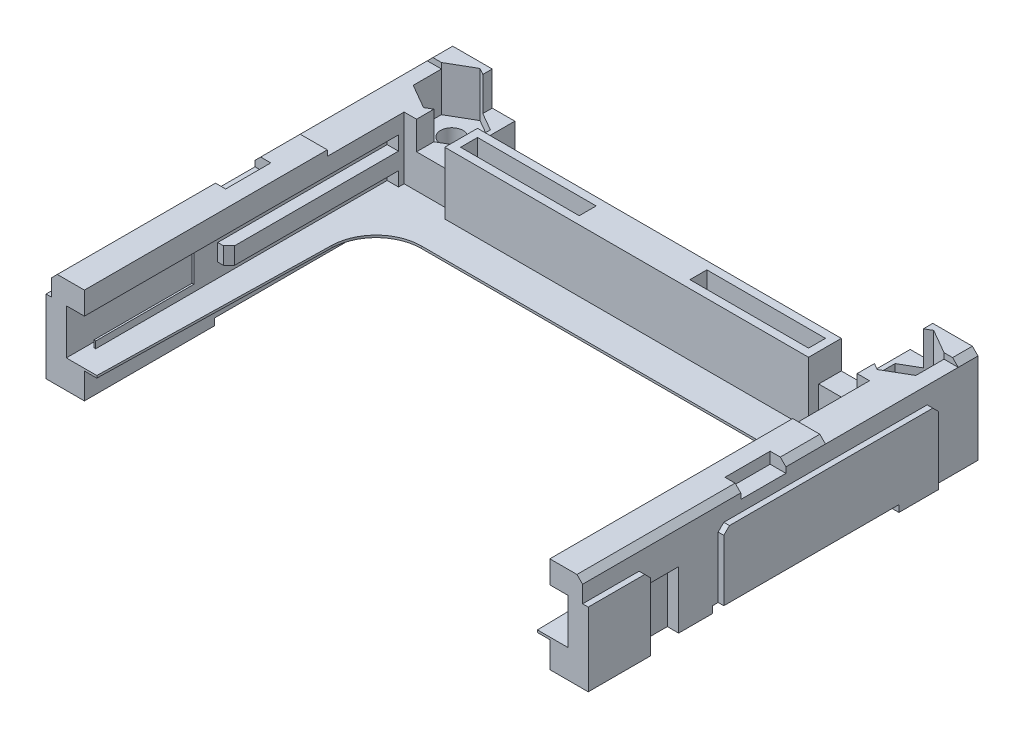
from build123d import *

# Parameters (mm, degrees)
EXTRUIR1_DEPTH         = 9.9
CROQUIS2_R             = 1
CORTAR_EXTRUIR1_DEPTH  = 15.9
CORTAR_EXTRUIR2_DEPTH  = 4
CROQUIS4_W             = 35
CROQUIS4_H             = 2.727458855
CORTAR_EXTRUIR3_DEPTH  = 24
CROQUIS5_W             = 35
CROQUIS5_H             = 3.2
CORTAR_EXTRUIR4_DEPTH  = 8.5
CROQUIS6_W             = 39
CROQUIS6_H             = 14.452712812
CORTAR_EXTRUIR5_DEPTH  = 3
EXTRUIR2_DEPTH         = 0.2
CROQUIS8_W             = 49.57319474
CROQUIS8_H             = 11.75
CORTAR_EXTRUIR6_DEPTH  = 0.5
CROQUIS9_W             = 2.460261438
CROQUIS9_H             = 4
CORTAR_EXTRUIR7_DEPTH  = 1
CHAFL_N1_SIZE          = 0.5
CHAFL_N2_SIZE          = 0.5
EXTRUIR3_START         = -5.5
CROQUIS10_W            = 32.2
CROQUIS10_H            = 2.9
EXTRUIR3_DEPTH         = 5.5
CROQUIS11_W            = 10.5
CROQUIS11_H            = 1.5
CORTAR_EXTRUIR8_DEPTH  = 2.5
CROQUIS12_W            = 16
CROQUIS12_H            = 2
CORTAR_EXTRUIR9_DEPTH  = 57.5
CROQUIS13_W            = 35
CROQUIS13_H            = 3.2
CORTAR_EXTRUIR10_DEPTH = 0.7
CROQUIS15_W            = 5.5
CROQUIS15_H            = 7.9
EXTRUIR4_DEPTH         = 0.5
CHAFL_N3_SIZE          = 0.5
CROQUIS16_W            = 3
CROQUIS16_H            = 6.5
CORTAR_EXTRUIR11_DEPTH = 1
CHAFL_N4_SIZE          = 0.5
CORTAR_EXTRUIR12_DEPTH = 1
CHAFL_N5_SIZE          = 0.5
CHAFL_N6_SIZE          = 0.5
CROQUIS18_W            = 0.4398817
CROQUIS18_H            = 4
CORTAR_EXTRUIR13_DEPTH = 22
CROQUIS19_W            = 10.696044144
CROQUIS19_H            = 2.8
CORTAR_EXTRUIR14_DEPTH = 0.2
CROQUIS20_W            = 2
CROQUIS20_H            = 4
CORTAR_EXTRUIR15_DEPTH = 0.2
CROQUIS21_W            = 42.865199157
CROQUIS21_H            = 3.067417921
CORTAR_EXTRUIR16_DEPTH = 58


with BuildPart() as part:
    # Croquis1 → Extruir1 (new body)
    with BuildSketch(Plane(origin=(0, 0, 0), x_dir=(1, 0, 0), z_dir=(0, 1, 0))):
        Polygon((23.5, 0), (-23.5, 0), (-23.5, -35), (-20.6, -35), (-20.6, -6.7), (20.6, -6.7), (20.6, -35), (23.5, -35), align=None)
    extrude(amount=EXTRUIR1_DEPTH)

    # Croquis2 → Cortar-Extruir1 (cut)
    with BuildSketch(Plane(origin=(0, 9.9, 0), x_dir=(-1, 0, 0), z_dir=(0, 1, 0))):
        with Locations(Location((-20.08, 3, 0), (0, 0, 90))):
            Circle(CROQUIS2_R)
        with Locations(Location((20.08, 3, 0), (0, 0, 90))):
            Circle(CROQUIS2_R)
    extrude(amount=-CORTAR_EXTRUIR1_DEPTH, mode=Mode.SUBTRACT)

    # Croquis3 → Cortar-Extruir2 (cut)
    with BuildSketch(Plane(origin=(0, 9.9, 0), x_dir=(-1, 0, 0), z_dir=(0, 1, 0))):
        Polygon((-20.08, 5.5), (-22.245063509, 4.25), (-22.245063509, 1.75), (-20.08, 0.5), (-17.914936491, 1.75), (-17.914936491, 4.25), align=None)
        Polygon((20.08, 5.5), (17.914936491, 4.25), (17.914936491, 1.75), (20.08, 0.5), (22.245063509, 1.75), (22.245063509, 4.25), align=None)
    extrude(amount=-CORTAR_EXTRUIR2_DEPTH, mode=Mode.SUBTRACT)

    # Croquis4 → Cortar-Extruir3 (cut)
    with BuildSketch(Plane(origin=(0, 9.9, 0), x_dir=(-1, 0, 0), z_dir=(0, 1, 0))):
        with Locations((0, 0.136270572)):
            Rectangle(CROQUIS4_W, CROQUIS4_H)
    extrude(amount=-CORTAR_EXTRUIR3_DEPTH, mode=Mode.SUBTRACT)

    # Croquis5 → Cortar-Extruir4 (cut)
    with BuildSketch(Plane(origin=(0, 9.9, 0), x_dir=(-1, 0, 0), z_dir=(0, 1, 0))):
        with Locations((0, 3.1)):
            Rectangle(CROQUIS5_W, CROQUIS5_H)
    extrude(amount=-CORTAR_EXTRUIR4_DEPTH, mode=Mode.SUBTRACT)

    # Croquis6 → Cortar-Extruir5 (cut)
    with BuildSketch(Plane(origin=(0, 9.9, 0), x_dir=(-1, 0, 0), z_dir=(0, 1, 0))):
        with Locations((0, 5.388219545)):
            Rectangle(CROQUIS6_W, CROQUIS6_H)
    extrude(amount=-CORTAR_EXTRUIR5_DEPTH, mode=Mode.SUBTRACT)

    # Croquis7 → Extruir2 (add)
    with BuildSketch(Plane(origin=(0, 3.9, 0), x_dir=(-1, 0, 0), z_dir=(0, 1, 0))):
        with BuildLine():
            Line((-20.6, 35), (-19.5, 35))
            Line((-19.5, 35), (-19.080611376, 14.617712891))
            ThreePointArc((-19.080611376, 14.617712891), (-17.880640918, 11.842628092), (-15.081457862, 10.7))
            Line((-15.081457862, 10.7), (15.081457862, 10.7))
            ThreePointArc((15.081457862, 10.7), (17.880640918, 11.842628092), (19.080611376, 14.617712891))
            Line((19.080611376, 14.617712891), (19.5, 35))
            Line((19.5, 35), (20.6, 35))
            Line((20.6, 35), (20.6, 6.7))
            Line((20.6, 6.7), (-20.6, 6.7))
            Line((-20.6, 6.7), (-20.6, 35))
        make_face()
    extrude(amount=-EXTRUIR2_DEPTH)

    # Croquis8 → Cortar-Extruir6 (cut)
    with BuildSketch(Plane(origin=(0, 9.9, 0), x_dir=(-1, 0, 0), z_dir=(0, 1, 0))):
        with Locations((0.155531932, 7.625)):
            Rectangle(CROQUIS8_W, CROQUIS8_H)
    extrude(amount=-CORTAR_EXTRUIR6_DEPTH, mode=Mode.SUBTRACT)

    # Croquis9 → Cortar-Extruir7 (cut)
    with BuildSketch(Plane(origin=(0, 9.9, 0), x_dir=(-1, 0, 0), z_dir=(0, 1, 0))):
        with Locations((23.330130719, 19)):
            Rectangle(CROQUIS9_W, CROQUIS9_H)
        with Locations((-23.330130719, 19)):
            Rectangle(CROQUIS9_W, CROQUIS9_H)
    extrude(amount=-CORTAR_EXTRUIR7_DEPTH, mode=Mode.SUBTRACT)

    # Chaflán1
    chafl_n1_edges = [part.edges().sort_by_distance(p)[0] for p in [
        (23.5, 9.9, 15.25),
        (23.5, 9.9, 28),
        (-23.5, 9.9, 28),
        (-23.5, 9.9, 15.25),
    ]]
    chamfer(chafl_n1_edges, length=CHAFL_N1_SIZE)

    # Chaflán2
    chafl_n2_edges = [part.edges().sort_by_distance(p)[0] for p in [
        (23.5, 9.9, 0.875),
        (-23.5, 9.9, 0.875),
    ]]
    chamfer(chafl_n2_edges, length=CHAFL_N2_SIZE)

    # Croquis10 → Extruir3 (add)
    with BuildSketch(Plane(origin=(0, 9.4, 0), x_dir=(-1, 0, 0), z_dir=(0, 1, 0)).offset(EXTRUIR3_START)):
        with Locations((0, 6.15)):
            Rectangle(CROQUIS10_W, CROQUIS10_H)
    extrude(amount=EXTRUIR3_DEPTH)

    # Croquis11 → Cortar-Extruir8 (cut)
    with BuildSketch(Plane(origin=(0, 9.4, 0), x_dir=(-1, 0, 0), z_dir=(0, 1, 0))):
        with Locations((-10.15, 6.15)):
            Rectangle(CROQUIS11_W, CROQUIS11_H)
        with Locations((10.15, 6.15)):
            Rectangle(CROQUIS11_W, CROQUIS11_H)
    extrude(amount=-CORTAR_EXTRUIR8_DEPTH, mode=Mode.SUBTRACT)

    # Croquis12 → Cortar-Extruir9 (cut)
    with BuildSketch(Plane.ZY.offset(23.5)):
        with Locations((15.5, 1)):
            Rectangle(CROQUIS12_W, CROQUIS12_H)
    extrude(amount=-CORTAR_EXTRUIR9_DEPTH, mode=Mode.SUBTRACT)

    # Croquis13 → Cortar-Extruir10 (cut)
    with BuildSketch(Plane.XZ):
        with Locations((0, 3.1)):
            Rectangle(CROQUIS13_W, CROQUIS13_H)
    extrude(amount=-CORTAR_EXTRUIR10_DEPTH, mode=Mode.SUBTRACT)

    # Croquis15 → Extruir4 (add)
    with BuildSketch(Plane.ZY.offset(23.5)):
        Polygon((4, 0), (4, 7.9), (23, 7.9), (23, 2), (7.5, 2), (7.5, 0), align=None)
        with Locations((32.25, 3.95)):
            Rectangle(CROQUIS15_W, CROQUIS15_H)
    extruir4 = extrude(amount=EXTRUIR4_DEPTH)

    # Chaflán3
    chafl_n3_edges = [part.edges().sort_by_distance(p)[0] for p in [
        (-23.75, 7.9, 29.5),
        (-23.75, 7.9, 23),
        (-23.75, 7.9, 4),
    ]]
    chamfer(chafl_n3_edges, length=CHAFL_N3_SIZE)

    # Croquis16 → Cortar-Extruir11 (cut)
    with BuildSketch(Plane.ZY.offset(23.5)):
        with Locations((28, 3.25)):
            Rectangle(CROQUIS16_W, CROQUIS16_H)
    cortar_extruir11 = extrude(amount=-CORTAR_EXTRUIR11_DEPTH, mode=Mode.SUBTRACT)

    # Simetría1: Extruir4, Cortar-Extruir11 across plane
    add(extruir4.mirror(Plane(origin=(0, 0, 0), x_dir=(0, 0, 1), z_dir=(1, 0, 0))))
    add(cortar_extruir11.mirror(Plane(origin=(0, 0, 0), x_dir=(0, 0, 1), z_dir=(1, 0, 0))), mode=Mode.SUBTRACT)

    # Chaflán4
    chafl_n4_edges = [part.edges().sort_by_distance(p)[0] for p in [
        (23.75, 7.9, 4),
        (23.75, 7.9, 23),
        (23.75, 7.9, 29.5),
    ]]
    chamfer(chafl_n4_edges, length=CHAFL_N4_SIZE)

    # Croquis17 → Cortar-Extruir12 (cut)
    with BuildSketch(Plane(origin=(-20.6, 0, 0), x_dir=(0, 0, -1), z_dir=(1, 0, 0))):
        Polygon((-35, 7.9), (-7.2, 7.9), (-7.2, 6.65), (-22.2, 6.65), (-22.2, 5.15), (-7.2, 5.15), (-7.2, 3.9), (-35, 3.9), align=None)
    cortar_extruir12 = extrude(amount=-CORTAR_EXTRUIR12_DEPTH, mode=Mode.SUBTRACT)

    # Chaflán5
    chafl_n5_edges = [part.edges().sort_by_distance(p)[0] for p in [
        (-20.6, 5.9, 22.2),
    ]]
    chamfer(chafl_n5_edges, length=CHAFL_N5_SIZE)

    # Simetría2: Cortar-Extruir12 across plane
    add(cortar_extruir12.mirror(Plane(origin=(0, 0, 0), x_dir=(0, 0, 1), z_dir=(1, 0, 0))), mode=Mode.SUBTRACT)

    # Chaflán6
    chafl_n6_edges = [part.edges().sort_by_distance(p)[0] for p in [
        (20.6, 5.9, 22.2),
    ]]
    chamfer(chafl_n6_edges, length=CHAFL_N6_SIZE)

    # Croquis18 → Cortar-Extruir13 (cut)
    with BuildSketch(Plane.XY.offset(35)):
        with Locations((-21.98005915, 5.9)):
            Rectangle(CROQUIS18_W, CROQUIS18_H)
        with Locations((21.98005915, 5.9)):
            Rectangle(CROQUIS18_W, CROQUIS18_H)
    extrude(amount=-CORTAR_EXTRUIR13_DEPTH, mode=Mode.SUBTRACT)

    # Croquis19 → Cortar-Extruir14 (cut)
    with BuildSketch(Plane(origin=(-21.6, 0, 0), x_dir=(0, 0, -1), z_dir=(1, 0, 0))):
        with Locations((-29.651977928, 5.9)):
            Rectangle(CROQUIS19_W, CROQUIS19_H)
    cortar_extruir14 = extrude(amount=-CORTAR_EXTRUIR14_DEPTH, mode=Mode.SUBTRACT)

    # Croquis20 → Cortar-Extruir15 (cut)
    with BuildSketch(Plane(origin=(-21.6, 0, 0), x_dir=(0, 0, -1), z_dir=(1, 0, 0))):
        with Locations((-34, 5.9)):
            Rectangle(CROQUIS20_W, CROQUIS20_H)
    cortar_extruir15 = extrude(amount=-CORTAR_EXTRUIR15_DEPTH, mode=Mode.SUBTRACT)

    # Simetría3: Cortar-Extruir14, Cortar-Extruir15 across plane
    add(cortar_extruir14.mirror(Plane(origin=(0, 0, 0), x_dir=(0, 0, 1), z_dir=(1, 0, 0))), mode=Mode.SUBTRACT)
    add(cortar_extruir15.mirror(Plane(origin=(0, 0, 0), x_dir=(0, 0, 1), z_dir=(1, 0, 0))), mode=Mode.SUBTRACT)

    # Croquis21 → Cortar-Extruir16 (cut)
    with BuildSketch(Plane(origin=(24, 0, 0), x_dir=(0, 0, -1), z_dir=(1, 0, 0))):
        with Locations((-17.067402922, -0.133708961)):
            Rectangle(CROQUIS21_W, CROQUIS21_H)
    extrude(amount=-CORTAR_EXTRUIR16_DEPTH, mode=Mode.SUBTRACT)


solid = part.part
